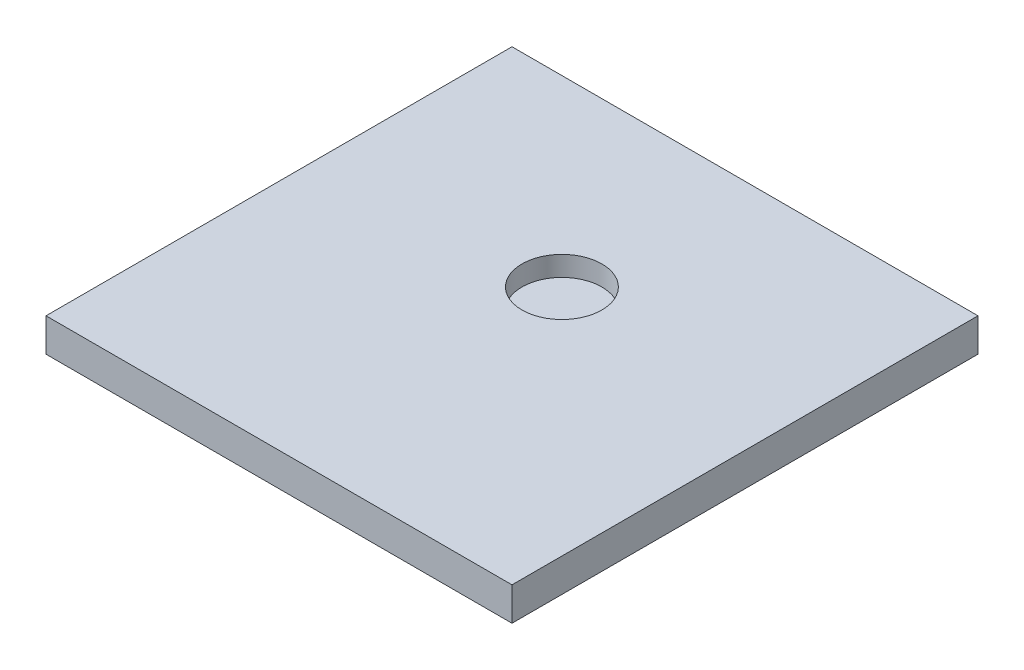
from build123d import *

# Parameters (mm, degrees)
SKETCH1_W           = 177.8
SKETCH1_H           = 177.8
BOSS_EXTRUDE1_DEPTH = 12.7
SKETCH2_R           = 15.24
CUT_EXTRUDE1_DEPTH  = 7.62


with BuildPart() as part:
    # Sketch1 → Boss-Extrude1 (new body)
    with BuildSketch(Plane(origin=(0, 0, 0), x_dir=(1, 0, 0), z_dir=(0, 1, 0))):
        with Locations((-0.186360549, 44.213132047)):
            Rectangle(SKETCH1_W, SKETCH1_H)
    extrude(amount=-BOSS_EXTRUDE1_DEPTH)

    # Sketch2 → Cut-Extrude1 (cut)
    with BuildSketch(Plane(origin=(0, 0, 0), x_dir=(1, 0, 0), z_dir=(0, 1, 0))):
        with Locations(Location((-0.186360549, 63.263132047, 0), (0, 0, 270))):
            Circle(SKETCH2_R)
    extrude(amount=-CUT_EXTRUDE1_DEPTH, mode=Mode.SUBTRACT)


solid = part.part
